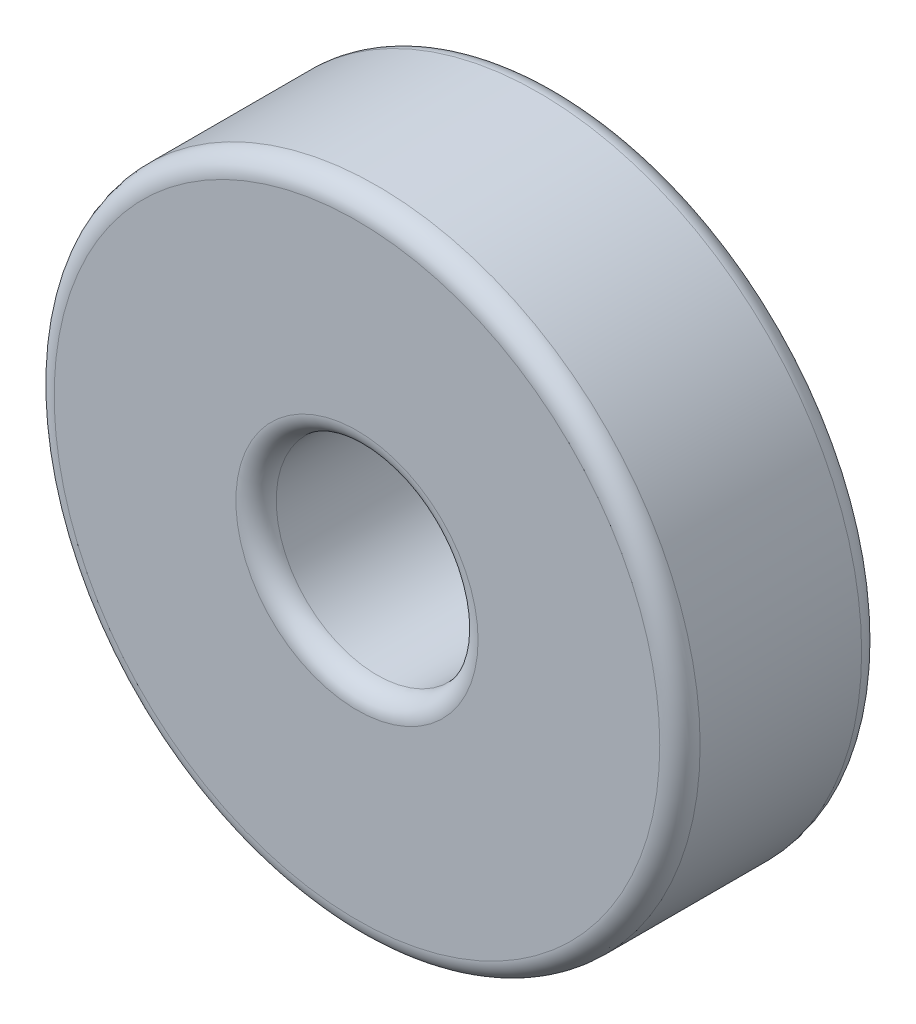
from build123d import *

# Parameters (mm, degrees)
CROQUIS1_R              = 8
CROQUIS1_R_2            = 2.5
SALIENTE_EXTRUIR1_DEPTH = 5
REDONDEO1_R             = 0.5


with BuildPart() as part:
    # Croquis1 → Saliente-Extruir1 (new body)
    with BuildSketch(Plane.XY):
        Circle(CROQUIS1_R)
        Circle(CROQUIS1_R_2, mode=Mode.SUBTRACT)
    extrude(amount=SALIENTE_EXTRUIR1_DEPTH)

    # Redondeo1
    redondeo1_edges = [part.edges().sort_by_distance(p)[0] for p in [
        (-8, 0, 0),
        (-8, 0, 5),
        (-2.5, 0, 0),
        (-2.5, 0, 5),
    ]]
    fillet(redondeo1_edges, radius=REDONDEO1_R)


solid = part.part
